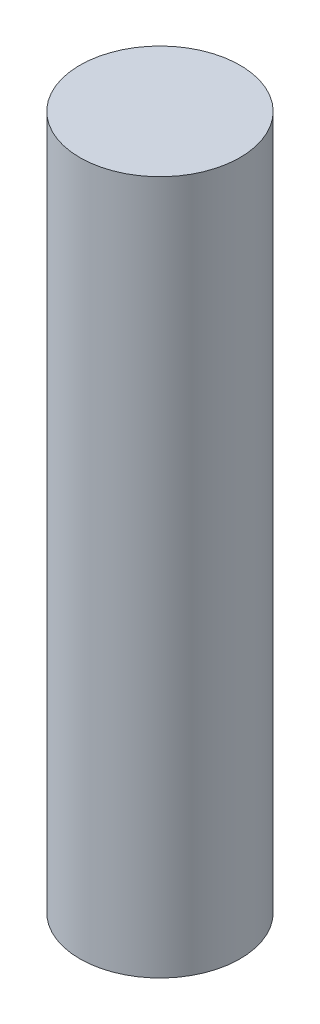
from build123d import *

# Parameters (mm, degrees)
CROQUIS1_R              = 1.5
SALIENTE_EXTRUIR1_DEPTH = 13


with BuildPart() as part:
    # Croquis1 → Saliente-Extruir1 (new body)
    with BuildSketch(Plane(origin=(0, 0, 0), x_dir=(1, 0, 0), z_dir=(0, 1, 0))):
        with Locations(Location((0, 0, 0), (0, 0, 270))):
            Circle(CROQUIS1_R)
    extrude(amount=SALIENTE_EXTRUIR1_DEPTH)


solid = part.part
